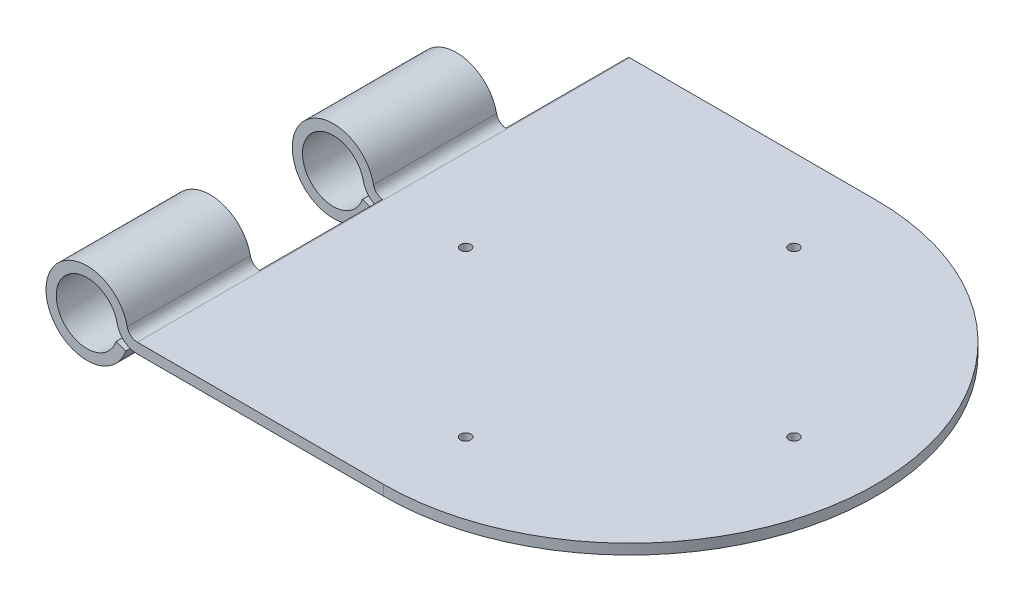
from build123d import *

# Parameters (mm, degrees)
BOSS_EXTRUDE1_DEPTH     = 76.2
CUT_EXTRUDE1_DEPTH      = 109.055004078
CUT_EXTRUDE1_DEPTH_BACK = 109.055004078
SKETCH2_W               = 19.05
SKETCH2_H               = 13.97
SKETCH3_R               = 0.79375
CUT_EXTRUDE2_DEPTH      = 114.673225775


with BuildPart() as part:
    # Sketch1 → Boss-Extrude1 (new body)
    with BuildSketch(Plane.XY):
        with BuildLine():
            Line((6.006670832, -2.059710057), (4.505003124, -1.544782543))
            ThreePointArc((4.505003124, -1.544782543), (-4.752599731, 0.306923518), (4.66627796, 0.9525))
            ThreePointArc((4.66627796, 0.9525), (5.769083619, -0.871844425), (7.777129933, -1.5875))
            Line((7.777129933, -1.5875), (83.977129933, -1.5875))
            Line((83.977129933, -1.5875), (83.977129933, 0))
            Line((83.977129933, 0), (7.777129933, 0))
            ThreePointArc((7.777129933, 0), (6.773106776, 0.357827788), (6.221703947, 1.27))
            ThreePointArc((6.221703947, 1.27), (-6.336799641, 0.409231357), (6.006670832, -2.059710057))
        make_face()
    extrude(amount=BOSS_EXTRUDE1_DEPTH)

    # Sketch2 → Cut-Extrude1 (cut, two sides: drawn at the far end of the back side and taken through both)
    with BuildSketch(Plane(origin=(69.85, -1.5875, 0), x_dir=(0, 0, -1), z_dir=(0, 1, 0)).offset(-CUT_EXTRUDE1_DEPTH_BACK)):
        with Locations((-9.525, 69.215)):
            Rectangle(SKETCH2_W, SKETCH2_H)
        with Locations((-47.625, 69.215)):
            Rectangle(SKETCH2_W, SKETCH2_H)
    extrude(amount=CUT_EXTRUDE1_DEPTH + CUT_EXTRUDE1_DEPTH_BACK, mode=Mode.SUBTRACT)

    # Sketch3 → Cut-Extrude2 (cut, through all)
    with BuildSketch(Plane(origin=(0, -1.5875, 0), x_dir=(1, 0, 0), z_dir=(0, 1, 0))):
        with BuildLine():
            Line((83.977129933, 0), (45.877129933, 0))
            ThreePointArc((45.877129933, 0), (72.817898258, -11.159231598), (83.977129933, -38.09999989))
            Line((83.977129933, -38.09999989), (83.977129933, 0))
        make_face()
        with BuildLine():
            Line((83.977129933, -76.2), (83.977129933, -38.09999989))
            ThreePointArc((83.977129933, -38.09999989), (72.817898336, -65.040768324), (45.877129933, -76.2))
            Line((45.877129933, -76.2), (83.977129933, -76.2))
        make_face()
        with Locations(Location((45.877129933, -63.5, 0), (0, 0, 90))):
            Circle(SKETCH3_R)
        with Locations(Location((20.477129933, -38.1, 0), (0, 0, 90))):
            Circle(SKETCH3_R)
        with Locations(Location((71.277129933, -38.1, 0), (0, 0, 90))):
            Circle(SKETCH3_R)
        with Locations(Location((45.877129933, -12.7, 0), (0, 0, 90))):
            Circle(SKETCH3_R)
    extrude(amount=CUT_EXTRUDE2_DEPTH, mode=Mode.SUBTRACT)


solid = part.part
